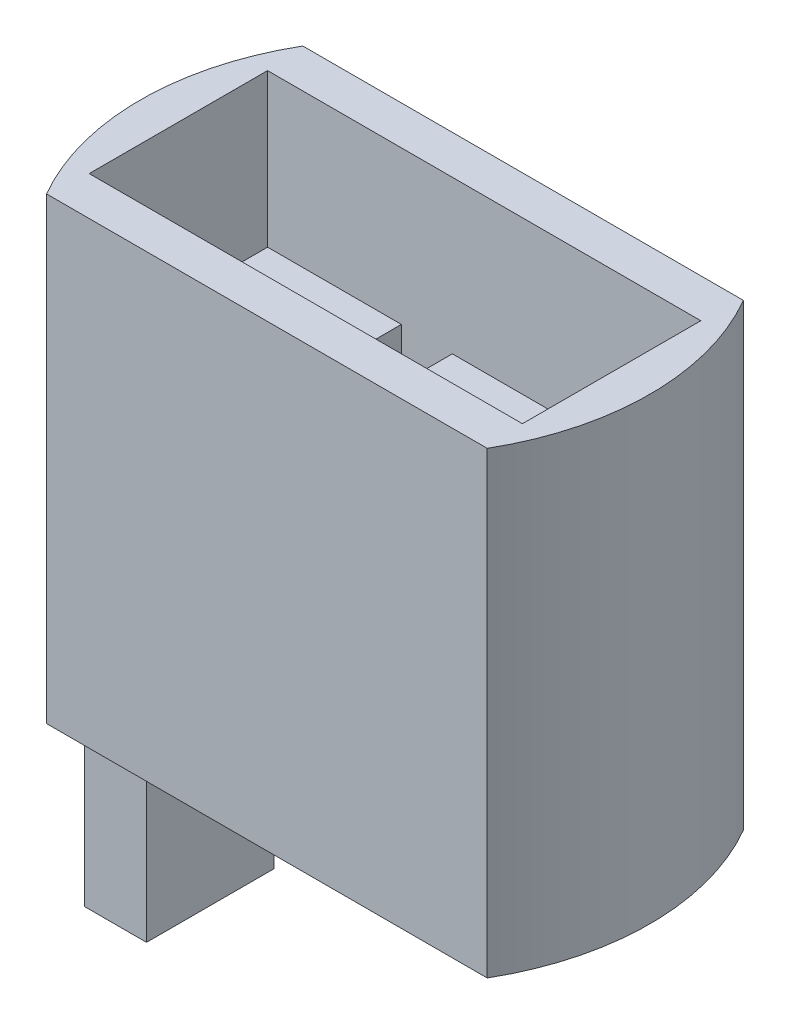
from build123d import *

# Parameters (mm, degrees)
SKETCH1_R           = 10
BOSS_EXTRUDE1_DEPTH = 18
SKETCH2_W           = 0.8
SKETCH2_H           = 5
BOSS_EXTRUDE2_DEPTH = 8
BOSS_EXTRUDE3_DEPTH = 1.2
SKETCH4_W           = 17
SKETCH4_H           = 7
CUT_EXTRUDE1_DEPTH  = 6
SKETCH5_W           = 2
SKETCH5_H           = 7
CUT_EXTRUDE2_DEPTH  = 4
CUT_EXTRUDE3_DEPTH  = 25
SKETCH7_W           = 5
SKETCH7_H           = 8
BOSS_EXTRUDE4_DEPTH = 0.8
CUT_EXTRUDE4_REACH  = 23.22


with BuildPart() as part:
    # Sketch1 → Boss-Extrude1 (new body)
    with BuildSketch(Plane(origin=(0, 0, 0), x_dir=(1, 0, 0), z_dir=(0, 1, 0))):
        with Locations(Location((0, 0, 0), (0, 0, 270))):
            Circle(SKETCH1_R)
    extrude(amount=BOSS_EXTRUDE1_DEPTH)

    # Sketch4 → Cut-Extrude1 (cut)
    with BuildSketch(Plane(origin=(0, 18, 0), x_dir=(1, 0, 0), z_dir=(0, 1, 0))):
        Rectangle(SKETCH4_W, SKETCH4_H)
    extrude(amount=-CUT_EXTRUDE1_DEPTH, mode=Mode.SUBTRACT)

    # Sketch5 → Cut-Extrude2 (cut)
    with BuildSketch(Plane(origin=(0, 12, 0), x_dir=(1, 0, 0), z_dir=(0, 1, 0))):
        with Locations((-2.25, 0)):
            Rectangle(SKETCH5_W, SKETCH5_H)
    extrude(amount=-CUT_EXTRUDE2_DEPTH, mode=Mode.SUBTRACT)

    # Sketch6 → Cut-Extrude3 (cut)
    with BuildSketch(Plane.XZ):
        with BuildLine():
            Line((-8.644632716, 5.026959838), (8.644632716, 5.026959838))
            ThreePointArc((8.644632716, 5.026959838), (0, 10), (-8.644632716, 5.026959838))
        make_face()
        with BuildLine():
            Line((-8.644632716, -5.026959838), (8.644632716, -5.026959838))
            ThreePointArc((8.644632716, -5.026959838), (0, -10), (-8.644632716, -5.026959838))
        make_face()
    extrude(amount=-CUT_EXTRUDE3_DEPTH, mode=Mode.SUBTRACT)



with BuildPart() as body_2:
    # Sketch2 → Boss-Extrude2 (new body)
    with BuildSketch(Plane(origin=(0, 0, 0), x_dir=(-1, 0, 0), z_dir=(0, -1, 0))):
        with Locations((7.65, 0)):
            Rectangle(SKETCH2_W, SKETCH2_H)
    extrude(amount=BOSS_EXTRUDE2_DEPTH)

    # Sketch3 → Boss-Extrude3 (add)
    with BuildSketch(Plane.ZY.offset(8.05)):
        Polygon((-2.5, -8), (-2.5, 0), (2.5, 0), (2.5, -8), (1.5, -8), (1.5, -0.75), (-1.5, -0.75), (-1.5, -8), align=None)
    extrude(amount=BOSS_EXTRUDE3_DEPTH)


with BuildPart() as part_1:
    add(part.part)

    add(body_2.part)  # Boss-Extrude4 merges body 2
    # Sketch7 → Boss-Extrude4 (add)
    with BuildSketch(Plane.ZY.offset(9.25)):
        with Locations((0, -4)):
            Rectangle(SKETCH7_W, SKETCH7_H)
    extrude(amount=BOSS_EXTRUDE4_DEPTH)

    # Sketch8 → Cut-Extrude4 (cut, up to next)
    with BuildSketch(Plane(origin=(0, 0, 0), x_dir=(1, 0, 0), z_dir=(0, 1, 0)), mode=Mode.PRIVATE) as cut_extrude4_sk1:
        with BuildLine():
            Line((-9.682458366, 2.5), (-10.05, 2.5))
            Line((-10.05, 2.5), (-10.05, -2.5))
            Line((-10.05, -2.5), (-9.682458366, -2.5))
            ThreePointArc((-9.682458366, -2.5), (-10, 0), (-9.682458366, 2.5))
        make_face()
    cut_extrude4_tool1 = extrude(cut_extrude4_sk1.sketch, amount=-CUT_EXTRUDE4_REACH, mode=Mode.PRIVATE) & part_1.part
    add(cut_extrude4_tool1.solids().sort_by_distance((-9.866229, 0, -2.449865))[0], mode=Mode.SUBTRACT)


solid = part_1.part
